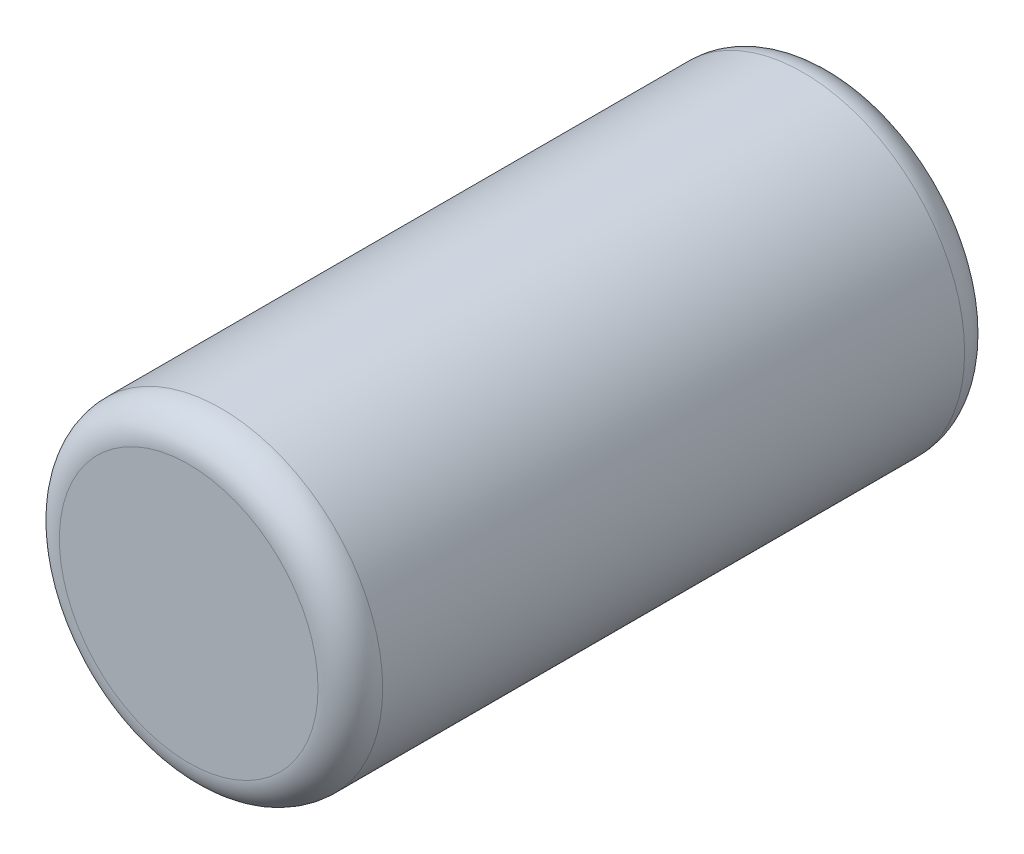
from build123d import *

# Parameters (mm, degrees)
SKETCH1_R           = 1.27
BOSS_EXTRUDE1_DEPTH = 2.54
FILLET2_R           = 0.254


with BuildPart() as part:
    # Sketch1 → Boss-Extrude1 (new, symmetric)
    with BuildSketch(Plane.XY):
        Circle(SKETCH1_R)
    extrude(amount=BOSS_EXTRUDE1_DEPTH, both=True)

    # Fillet2
    fillet2_edges = [part.edges().sort_by_distance(p)[0] for p in [
        (-1.27, 0, -2.54),
        (-1.27, 0, 2.54),
    ]]
    fillet(fillet2_edges, radius=FILLET2_R)


solid = part.part
